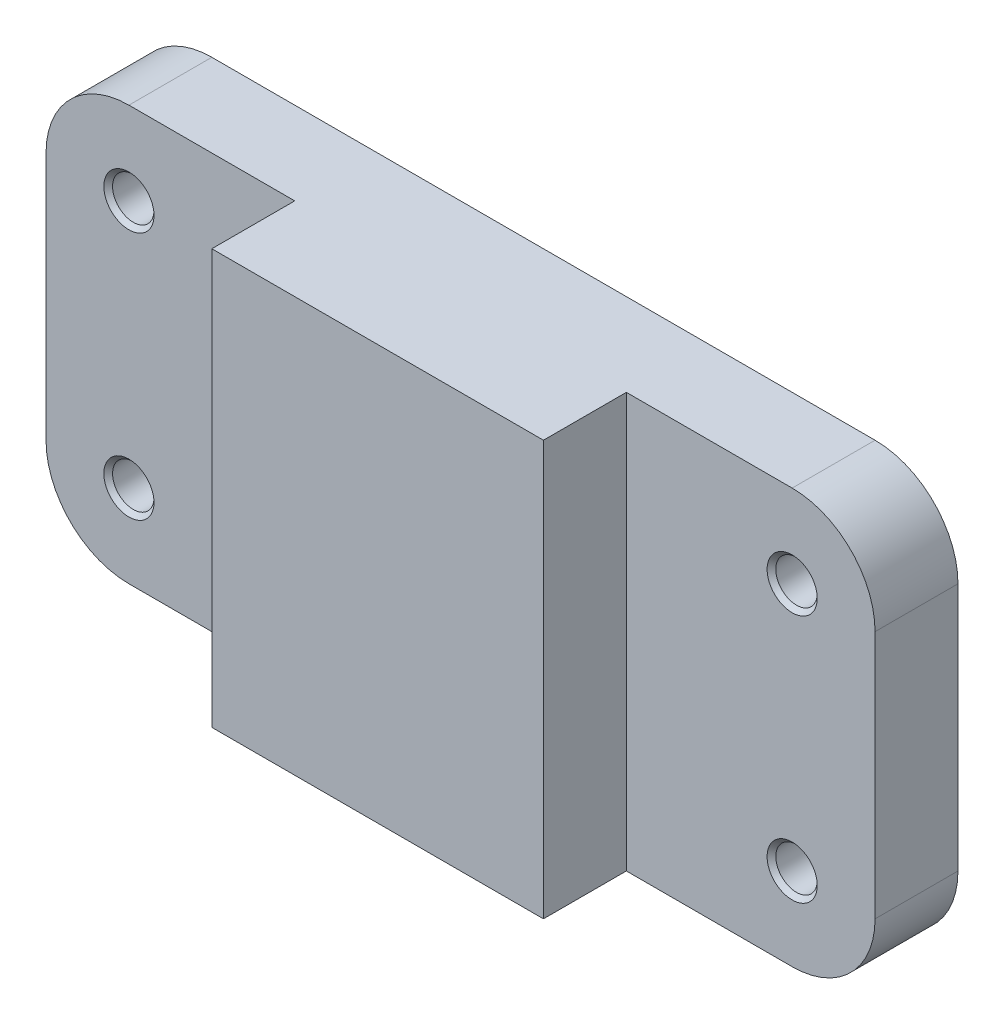
from build123d import *

# Parameters (mm, degrees)
SKETCH_1_W                   = 100
SKETCH_1_H                   = 50
EXTRUDE_1_DEPTH              = 10
SKETCH_2_W                   = 40
SKETCH_2_H                   = 50
EXTRUDE_2_DEPTH              = 10
FILLET_1_R                   = 10
HOLE_WIZARD_M6_1_D           = 5
HOLE_WIZARD_M6_1_CSINK_D     = 6.05
HOLE_WIZARD_M6_1_CSINK_ANGLE = 90


with BuildPart() as part:
    # 草图1 → 凸台-拉伸1 (new body)
    with BuildSketch(Plane.XY):
        Rectangle(SKETCH_1_W, SKETCH_1_H)
    extrude(amount=EXTRUDE_1_DEPTH)

    # 草图2 → 凸台-拉伸2 (add)
    with BuildSketch(Plane.XY.offset(10)):
        Rectangle(SKETCH_2_W, SKETCH_2_H)
    extrude(amount=EXTRUDE_2_DEPTH)

    # 圆角1
    fillet_1_edges = [part.edges().sort_by_distance(p)[0] for p in [
        (50, -25, 5),
        (-50, -25, 5),
        (-50, 25, 5),
        (50, 25, 5),
    ]]
    fillet(fillet_1_edges, radius=FILLET_1_R)

    # M6 螺纹孔1 (through all)
    with Locations(Plane.XY.offset(10)):
        with Locations((-40, 15), (-40, -15), (40, -15), (40, 15)):
            CounterSinkHole(HOLE_WIZARD_M6_1_D / 2, HOLE_WIZARD_M6_1_CSINK_D / 2, counter_sink_angle=HOLE_WIZARD_M6_1_CSINK_ANGLE)


solid = part.part
